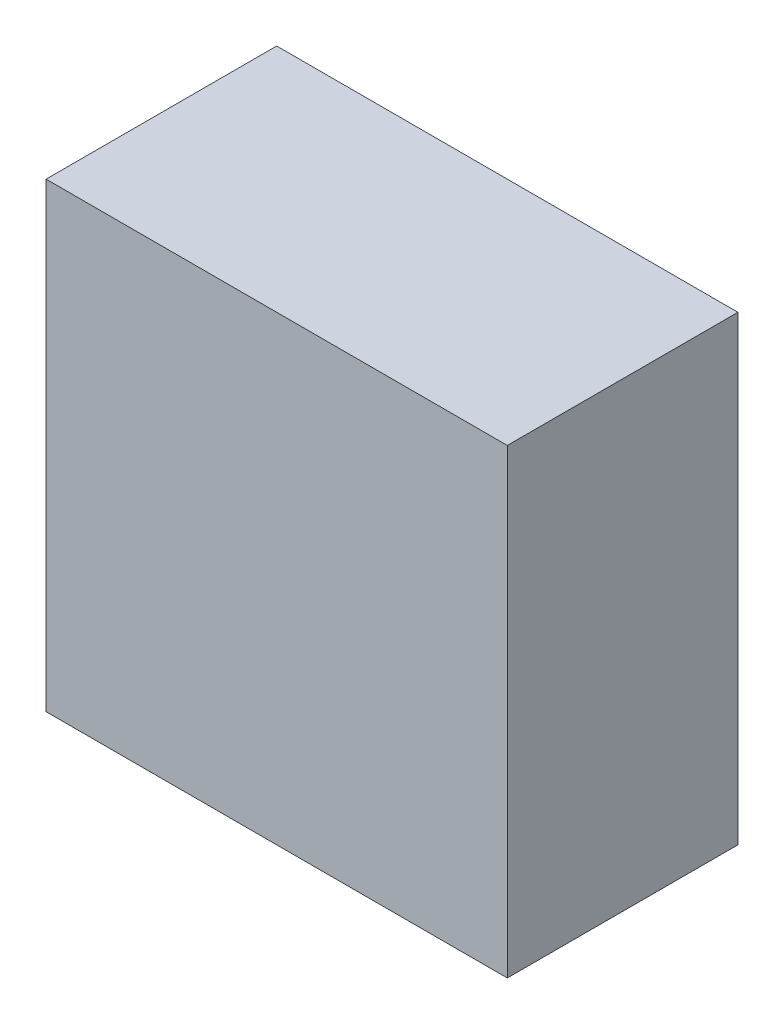
from build123d import *

# Parameters (mm, degrees)
SKICA1_W                 = 20
SKICA1_H                 = 20
P_IDAT_VYSUNUT_M1_DEPTH  = 10
SKICA2_W                 = 17
SKICA2_H                 = 17
ODEBRAT_VYSUNUT_M1_DEPTH = 7.5
SKICA3_R                 = 2.65
P_IDAT_VYSUNUT_M2_DEPTH  = 7.5
ODEBRAT_VYSUNUT_M2_DEPTH = 7.5


with BuildPart() as part:
    # Skica1 → Přidat vysunutím1 (new body)
    with BuildSketch(Plane.XY):
        Rectangle(SKICA1_W, SKICA1_H)
    extrude(amount=P_IDAT_VYSUNUT_M1_DEPTH)

    # Skica2 → Odebrat vysunutím1 (cut)
    with BuildSketch(Plane(origin=(0, 0, 0), x_dir=(-1, 0, 0), z_dir=(0, 0, -1))):
        Rectangle(SKICA2_W, SKICA2_H)
    extrude(amount=-ODEBRAT_VYSUNUT_M1_DEPTH, mode=Mode.SUBTRACT)

    # Skica3 → Přidat vysunutím2 (add)
    with BuildSketch(Plane(origin=(0, 0, 7.5), x_dir=(-1, 0, 0), z_dir=(0, 0, -1))):
        with Locations(Location((0, 0, 0), (0, 0, 180))):
            Circle(SKICA3_R)
    extrude(amount=P_IDAT_VYSUNUT_M2_DEPTH)

    # Skica4 → Odebrat vysunutím2 (cut)
    with BuildSketch(Plane(origin=(0, 0, 0), x_dir=(-1, 0, 0), z_dir=(0, 0, -1))):
        Polygon((-0.65, 2.15), (0.65, 2.15), (0.65, 0.65), (2.15, 0.65), (2.15, -0.65), (0.65, -0.65), (0.65, -2.15), (-0.65, -2.15), (-0.65, -0.65), (-2.15, -0.65), (-2.15, 0.65), (-0.65, 0.65), align=None)
    extrude(amount=-ODEBRAT_VYSUNUT_M2_DEPTH, mode=Mode.SUBTRACT)


solid = part.part
